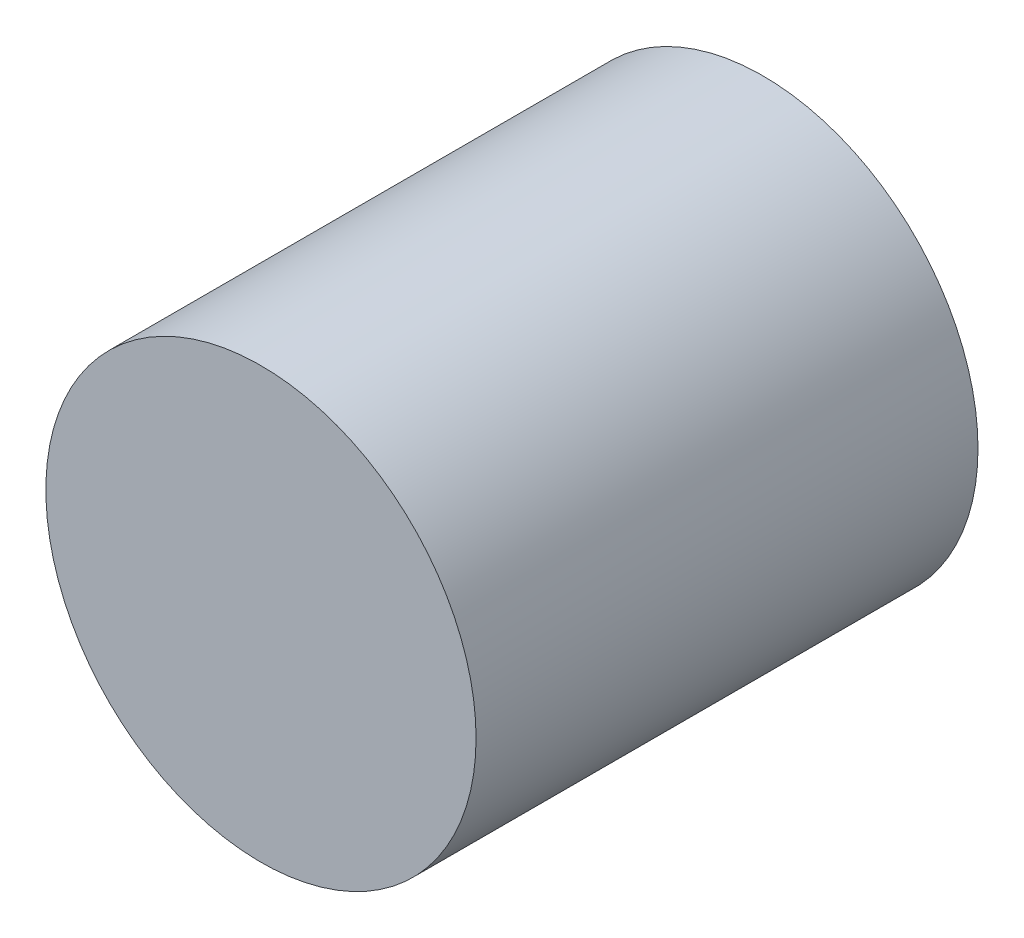
from build123d import *

# Parameters (mm, degrees)
SKETCH_272_R          = 15
EXTRUDE_455_DEPTH     = 35
SKETCH_4_W            = 15.2
SKETCH_4_H            = 15.2
CUT_EXTRUDE_504_DEPTH = 30


with BuildPart() as part:
    # Sketch 272 → Extrude 455 (new body)
    with BuildSketch(Plane.XY):
        Circle(SKETCH_272_R)
    extrude(amount=EXTRUDE_455_DEPTH)

    # основа<4> → Cut-Extrude 504 (cut)
    with BuildSketch(Plane.XY):
        Rectangle(SKETCH_4_W, SKETCH_4_H)
    extrude(amount=CUT_EXTRUDE_504_DEPTH, mode=Mode.SUBTRACT)


solid = part.part
